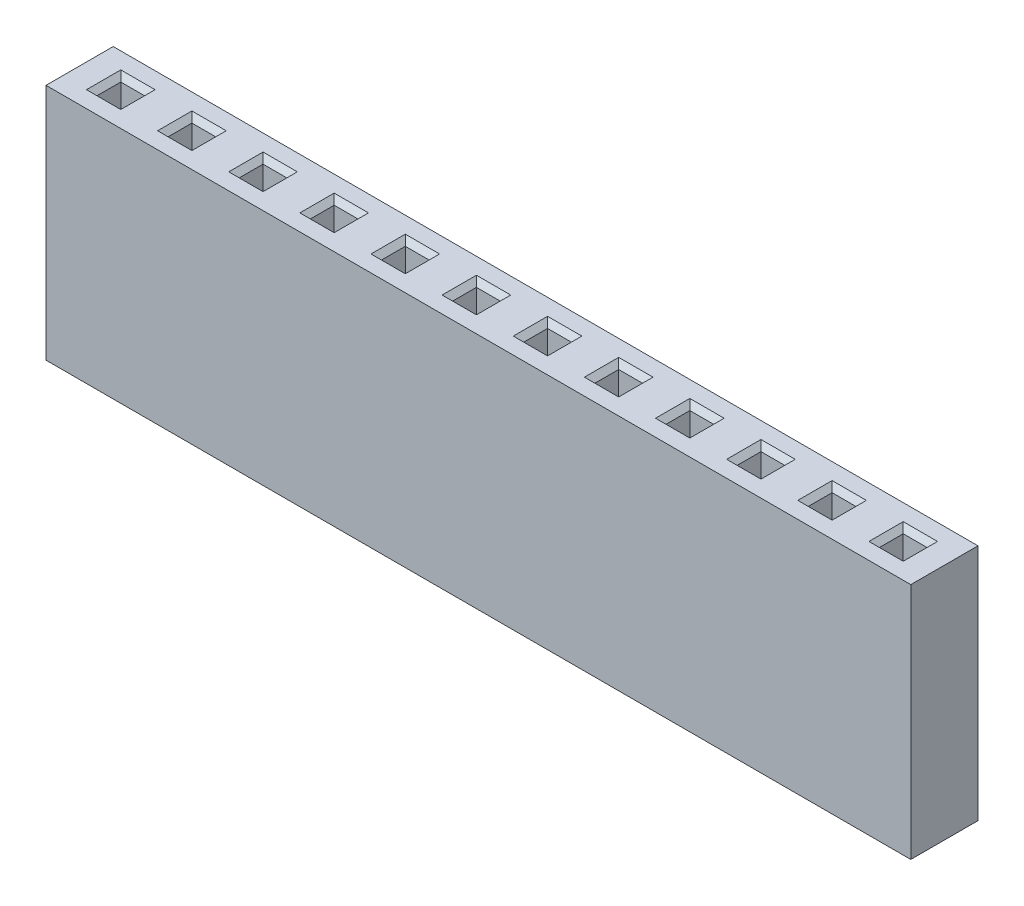
from build123d import *

# Parameters (mm, degrees)
SKETCH1_W                  = 30.88
SKETCH1_H                  = 8.5
BOSS_EXTRUDE1_DEPTH        = 2.4
SKETCH2_W                  = 0.85
SKETCH2_H                  = 0.85
CUT_EXTRUDE1_DEPTH         = 18.787737349
CHAMFER1_SIZE              = 0.1875
LPATTERN1_COUNT            = 12
LPATTERN1_PITCH            = 2.54
CHAMFER1_OF_LPATTERN1_SIZE = 0.1875


with BuildPart() as part:
    # Sketch1 → Boss-Extrude1 (new body)
    with BuildSketch(Plane.XY):
        Rectangle(SKETCH1_W, SKETCH1_H)
    extrude(amount=BOSS_EXTRUDE1_DEPTH)

    # Sketch2 → Cut-Extrude1 (cut, through all)
    with BuildSketch(Plane(origin=(0, 4.25, 0), x_dir=(1, 0, 0), z_dir=(0, 1, 0))):
        with Locations((-13.97, -1.2)):
            Rectangle(SKETCH2_W, SKETCH2_H)
    cut_extrude1 = extrude(amount=-CUT_EXTRUDE1_DEPTH, mode=Mode.SUBTRACT)

    # Chamfer1
    chamfer1_edges = [part.edges().sort_by_distance(p)[0] for p in [
        (-13.545, 4.25, 1.2),
        (-13.97, 4.25, 0.775),
        (-14.395, 4.25, 1.2),
        (-13.97, 4.25, 1.625),
    ]]
    chamfer(chamfer1_edges, length=CHAMFER1_SIZE)

    # LPattern1: Cut-Extrude1 ×12
    with Locations(*[(i * LPATTERN1_PITCH, 0, 0) for i in range(1, LPATTERN1_COUNT)]):
        add(cut_extrude1, mode=Mode.SUBTRACT)

    # Chamfer1 of LPattern1
    chamfer1_of_lpattern1_edges = [part.edges().sort_by_distance(p)[0] for p in [
        (-11.005, 4.25, 1.2),
        (-11.43, 4.25, 0.775),
        (-11.855, 4.25, 1.2),
        (-11.43, 4.25, 1.625),
        (-8.465, 4.25, 1.2),
        (-8.89, 4.25, 0.775),
        (-9.315, 4.25, 1.2),
        (-8.89, 4.25, 1.625),
        (-5.925, 4.25, 1.2),
        (-6.35, 4.25, 0.775),
        (-6.775, 4.25, 1.2),
        (-6.35, 4.25, 1.625),
        (-3.385, 4.25, 1.2),
        (-3.81, 4.25, 0.775),
        (-4.235, 4.25, 1.2),
        (-3.81, 4.25, 1.625),
        (-0.845, 4.25, 1.2),
        (-1.27, 4.25, 0.775),
        (-1.695, 4.25, 1.2),
        (-1.27, 4.25, 1.625),
        (1.695, 4.25, 1.2),
        (1.27, 4.25, 0.775),
        (0.845, 4.25, 1.2),
        (1.27, 4.25, 1.625),
        (4.235, 4.25, 1.2),
        (3.81, 4.25, 0.775),
        (3.385, 4.25, 1.2),
        (3.81, 4.25, 1.625),
        (6.775, 4.25, 1.2),
        (6.35, 4.25, 0.775),
        (5.925, 4.25, 1.2),
        (6.35, 4.25, 1.625),
        (9.315, 4.25, 1.2),
        (8.89, 4.25, 0.775),
        (8.465, 4.25, 1.2),
        (8.89, 4.25, 1.625),
        (11.855, 4.25, 1.2),
        (11.43, 4.25, 0.775),
        (11.005, 4.25, 1.2),
        (11.43, 4.25, 1.625),
        (14.395, 4.25, 1.2),
        (13.97, 4.25, 0.775),
        (13.545, 4.25, 1.2),
        (13.97, 4.25, 1.625),
    ]]
    chamfer(chamfer1_of_lpattern1_edges, length=CHAMFER1_OF_LPATTERN1_SIZE)


solid = part.part
